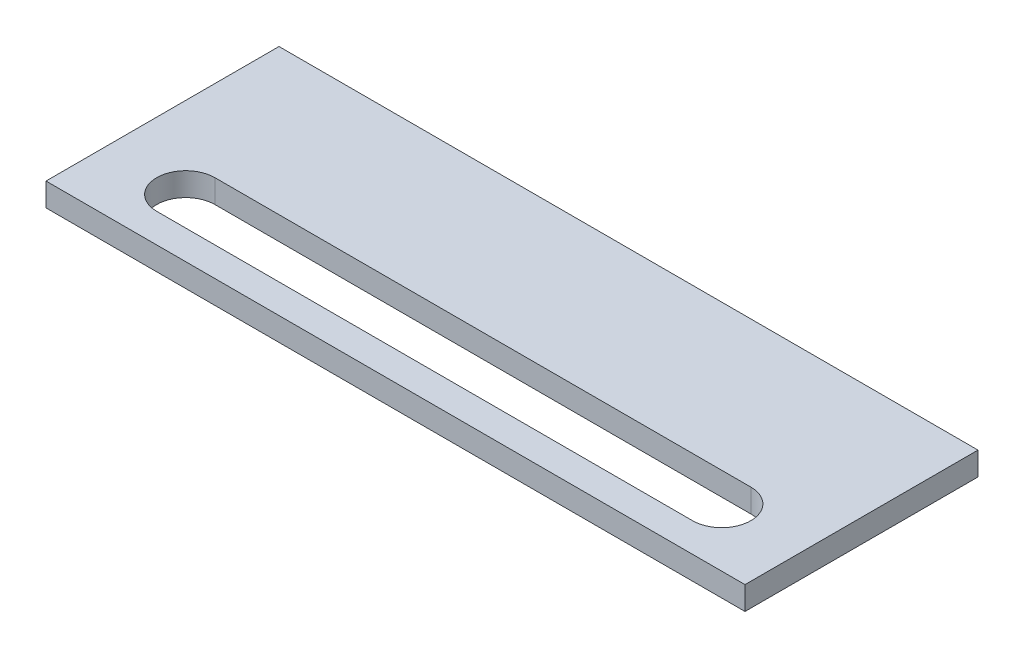
from build123d import *

# Parameters (mm, degrees)
SKETCH1_W           = 76.2
SKETCH1_H           = 25.4
BOSS_EXTRUDE1_DEPTH = 2.54


with BuildPart() as part:
    # Sketch1 → Boss-Extrude1 (new body)
    with BuildSketch(Plane(origin=(0, 0, 0), x_dir=(1, 0, 0), z_dir=(0, 1, 0))):
        with Locations((0, -12.7)):
            Rectangle(SKETCH1_W, SKETCH1_H)
        with BuildLine():
            Line((-29.21, -15.875), (29.21, -15.875))
            ThreePointArc((29.21, -15.875), (32.385, -19.05), (29.21, -22.225))
            Line((29.21, -22.225), (-29.21, -22.225))
            ThreePointArc((-29.21, -22.225), (-32.385, -19.05), (-29.21, -15.875))
        make_face(mode=Mode.SUBTRACT)
    extrude(amount=BOSS_EXTRUDE1_DEPTH)


solid = part.part
